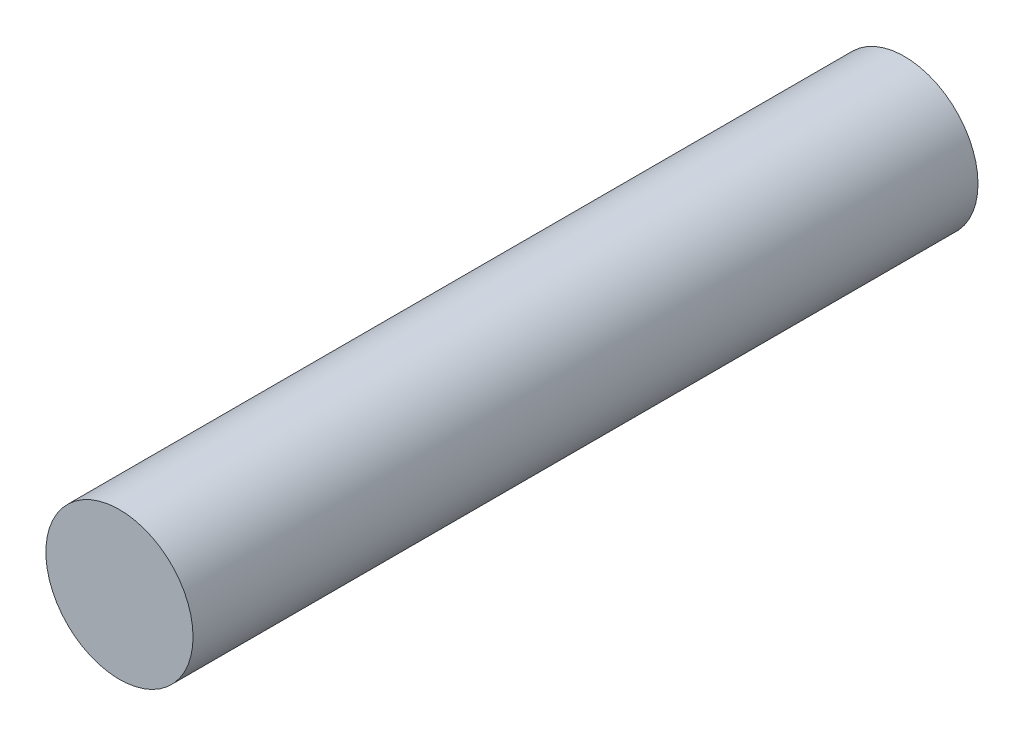
from build123d import *

# Parameters (mm, degrees)
SKETCH1_R           = 4.7625
BOSS_EXTRUDE1_DEPTH = 50.8


with BuildPart() as part:
    # Sketch1 → Boss-Extrude1 (new body)
    with BuildSketch(Plane.XY):
        Circle(SKETCH1_R)
    extrude(amount=BOSS_EXTRUDE1_DEPTH)


solid = part.part
